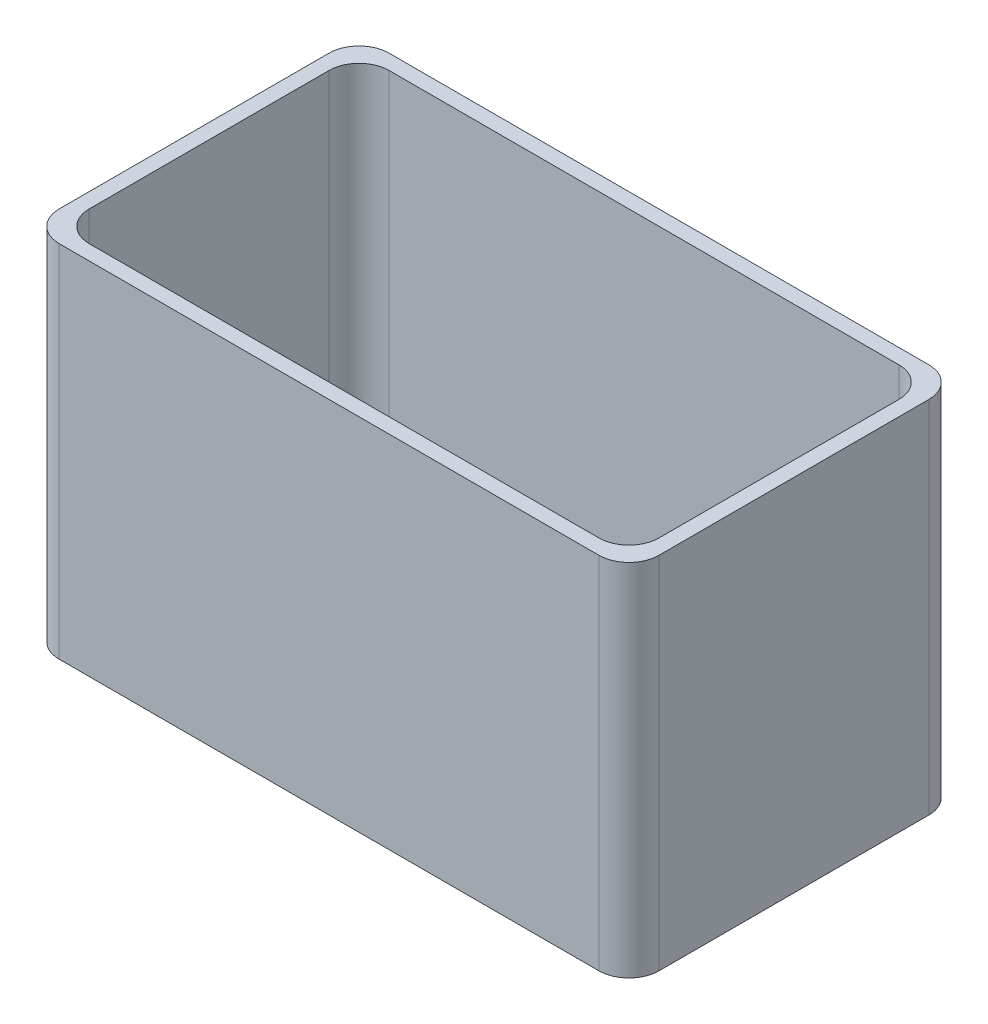
from build123d import *

# Parameters (mm, degrees)
SKETCH1_W           = 200
SKETCH1_H           = 110
BOSS_EXTRUDE1_DEPTH = 6
SKETCH2_W           = 200
SKETCH2_H           = 110
SKETCH2_W_2         = 190
SKETCH2_H_2         = 100
BOSS_EXTRUDE2_DEPTH = 114
SKETCH3_W           = 110
SKETCH3_H           = 20
CUT_EXTRUDE1_DEPTH  = 256.139177705
SKETCH4_W           = 120
SKETCH4_H           = 30
SKETCH4_W_2         = 110
SKETCH4_H_2         = 20
BOSS_EXTRUDE3_DEPTH = 15
CHAMFER2_SIZE       = 3
FILLET1_R           = 10
FILLET2_R           = 4


with BuildPart() as part:
    # Sketch1 → Boss-Extrude1 (new body)
    with BuildSketch(Plane(origin=(0, 0, 0), x_dir=(1, 0, 0), z_dir=(0, 1, 0))):
        with Locations((100, 55)):
            Rectangle(SKETCH1_W, SKETCH1_H)
    extrude(amount=BOSS_EXTRUDE1_DEPTH)

    # Sketch2 → Boss-Extrude2 (add)
    with BuildSketch(Plane(origin=(0, 6, 0), x_dir=(1, 0, 0), z_dir=(0, 1, 0))):
        with Locations((100, 55)):
            Rectangle(SKETCH2_W, SKETCH2_H)
        with Locations((100, 55)):
            Rectangle(SKETCH2_W_2, SKETCH2_H_2, mode=Mode.SUBTRACT)
    extrude(amount=BOSS_EXTRUDE2_DEPTH)

    # Sketch3 → Cut-Extrude1 (cut, through all)
    with BuildSketch(Plane(origin=(0, 6, 0), x_dir=(1, 0, 0), z_dir=(0, 1, 0))):
        with Locations((100, 55)):
            Rectangle(SKETCH3_W, SKETCH3_H)
    extrude(amount=-CUT_EXTRUDE1_DEPTH, mode=Mode.SUBTRACT)

    # Sketch4 → Boss-Extrude3 (add)
    with BuildSketch(Plane(origin=(0, 6, 0), x_dir=(1, 0, 0), z_dir=(0, 1, 0))):
        with Locations((100, 55)):
            Rectangle(SKETCH4_W, SKETCH4_H)
        with Locations((100, 55)):
            Rectangle(SKETCH4_W_2, SKETCH4_H_2, mode=Mode.SUBTRACT)
    extrude(amount=BOSS_EXTRUDE3_DEPTH)

    # Chamfer2
    chamfer2_edges = [part.edges().sort_by_distance(p)[0] for p in [
        (45, 0, -55),
        (100, 0, -65),
        (155, 0, -55),
        (100, 0, -45),
    ]]
    chamfer(chamfer2_edges, length=CHAMFER2_SIZE)

    # Fillet1
    fillet1_edges = [part.edges().sort_by_distance(p)[0] for p in [
        (5, 6, -55),
        (100, 6, -5),
        (195, 6, -55),
        (100, 6, -105),
        (195, 63, -5),
        (195, 63, -105),
        (5, 63, -105),
        (5, 63, -5),
        (0, 60, -110),
        (200, 60, -110),
        (200, 60, 0),
        (0, 60, 0),
    ]]
    fillet(fillet1_edges, radius=FILLET1_R)

    # Fillet2
    fillet2_edges = [part.edges().sort_by_distance(p)[0] for p in [
        (100, 6, -70),
        (160, 13.5, -70),
        (40, 6, -55),
        (40, 13.5, -70),
        (100, 6, -40),
        (40, 13.5, -40),
        (160, 6, -55),
        (160, 13.5, -40),
        (155, 12, -45),
        (155, 12, -65),
        (45, 12, -65),
        (45, 12, -45),
    ]]
    fillet(fillet2_edges, radius=FILLET2_R)


solid = part.part
